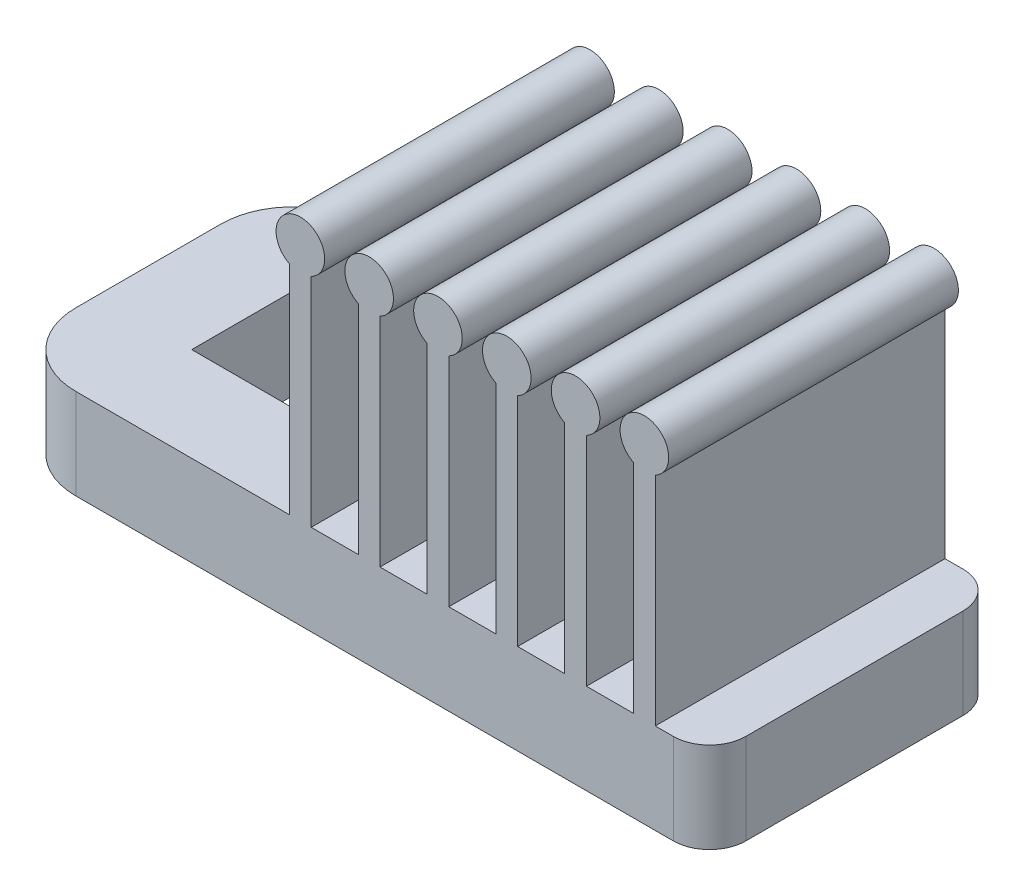
from build123d import *

# Parameters (mm, degrees)
RESSALTO_EXTRUS_O1_DEPTH = 8
ESBO_O2_W                = 2.8
ESBO_O2_H                = 2.8
CORTE_EXTRUS_O2_DEPTH    = 20.45530599


with BuildPart() as part:
    # Esboço1 → Ressalto-extrusão1 (new body)
    with BuildSketch(Plane.XY):
        with BuildLine():
            Line((0, 0), (-4.7, 0))
            Line((-4.7, 0), (-4.7, -2.5))
            Line((-4.7, -2.5), (-0.2, -2.5))
            Line((-0.2, -2.5), (14.8, -2.5))
            Line((14.8, -2.5), (14.8, 0))
            Line((14.8, 0), (13.3, 0))
            Line((13.3, 0), (13.3, 6))
            ThreePointArc((13.3, 6), (13, 7.270820393), (12.7, 6))
            Line((12.7, 6), (12.7, 0))
            Line((12.7, 0), (11.4, 0))
            Line((11.4, 0), (11.4, 6))
            ThreePointArc((11.4, 6), (11.1, 7.270820393), (10.8, 6))
            Line((10.8, 6), (10.8, 0))
            Line((10.8, 0), (9.5, 0))
            Line((9.5, 0), (9.5, 6))
            ThreePointArc((9.5, 6), (9.2, 7.270820393), (8.9, 6))
            Line((8.9, 6), (8.9, 0))
            Line((8.9, 0), (7.6, 0))
            Line((7.6, 0), (7.6, 6))
            ThreePointArc((7.6, 6), (7.3, 7.270820393), (7, 6))
            Line((7, 6), (7, 0))
            Line((7, 0), (5.7, 0))
            Line((5.7, 0), (5.7, 6))
            ThreePointArc((5.7, 6), (5.4, 7.270820393), (5.1, 6))
            Line((5.1, 6), (5.1, 0))
            Line((5.1, 0), (3.8, 0))
            Line((3.8, 0), (3.8, 6))
            ThreePointArc((3.8, 6), (3.5, 7.270820393), (3.2, 6))
            Line((3.2, 6), (3.2, 0))
            Line((3.2, 0), (1.9, 0))
            Line((1.9, 0), (1.3, 0))
            Line((1.3, 0), (0, 0))
        make_face()
    extrude(amount=RESSALTO_EXTRUS_O1_DEPTH)

    # Esboço2 → Corte-extrusão2 (cut, through all)
    with BuildSketch(Plane.XZ.offset(2.5)):
        with BuildLine():
            Line((-2.7, 8), (-4.7, 8))
            Line((-4.7, 8), (-4.7, 6))
            ThreePointArc((-4.7, 6), (-4.114213562, 7.414213562), (-2.7, 8))
        make_face()
        with BuildLine():
            Line((-4.7, 2), (-4.7, 0))
            Line((-4.7, 0), (-2.7, 0))
            ThreePointArc((-2.7, 0), (-4.114213562, 0.585786438), (-4.7, 2))
        make_face()
        with Locations((-0.7, 4)):
            Rectangle(ESBO_O2_W, ESBO_O2_H)
        with BuildLine():
            Line((13.8, 8), (14.8, 8))
            Line((14.8, 8), (14.8, 7))
            ThreePointArc((14.8, 7), (14.507106781, 7.707106781), (13.8, 8))
        make_face()
        with BuildLine():
            Line((13.8, 0), (14.8, 0))
            Line((14.8, 0), (14.8, 1))
            ThreePointArc((14.8, 1), (14.507106781, 0.292893219), (13.8, 0))
        make_face()
    extrude(amount=-CORTE_EXTRUS_O2_DEPTH, mode=Mode.SUBTRACT)


solid = part.part
